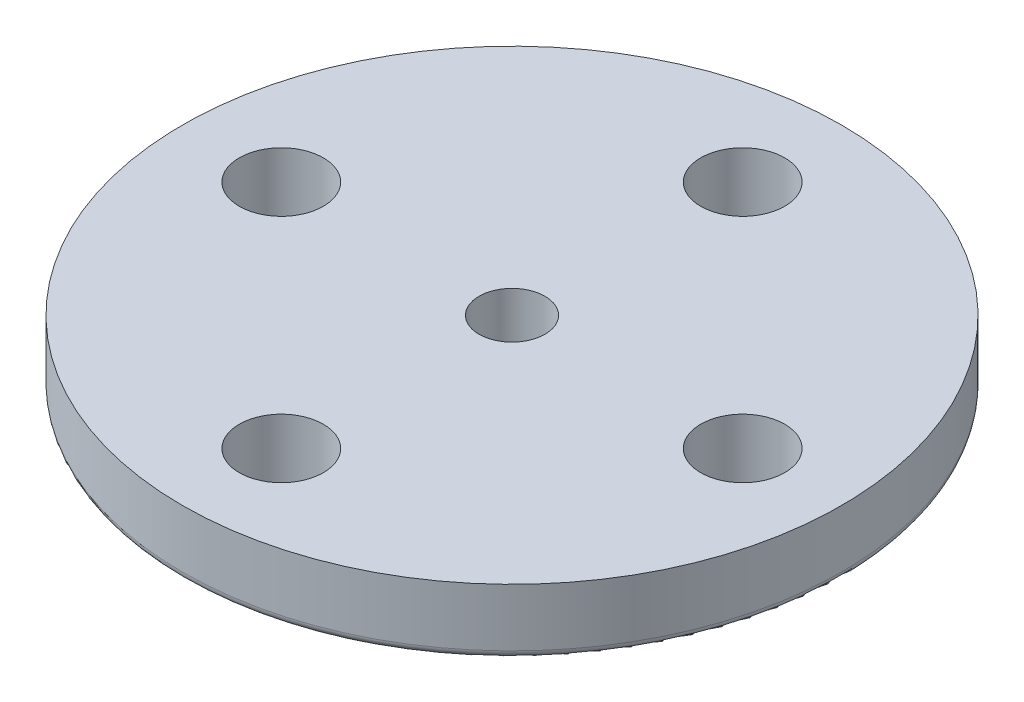
from build123d import *

# Parameters (mm, degrees)
SKETCH1_R           = 10
BOSS_EXTRUDE1_DEPTH = 2
SKETCH2_R           = 4.5
BOSS_EXTRUDE2_DEPTH = 2.5
SKETCH3_R           = 1.275
CUT_EXTRUDE1_DEPTH  = 15.361406616
FILLET1_R           = 0.25
SKETCH6_R           = 1
CUT_EXTRUDE2_DEPTH  = 15.840822214
SKETCH7_R           = 2.9
CUT_EXTRUDE3_DEPTH  = 2.5
BOSS_EXTRUDE4_DEPTH = 2.5
CIRPATTERN1_COUNT   = 26


with BuildPart() as part:
    # Sketch1 → Boss-Extrude1 (new body)
    with BuildSketch(Plane(origin=(0, 0, 0), x_dir=(1, 0, 0), z_dir=(0, 1, 0))):
        with Locations(Location((0, 0, 0), (0, 0, 270))):
            Circle(SKETCH1_R)
    extrude(amount=BOSS_EXTRUDE1_DEPTH)

    # Sketch2 → Boss-Extrude2 (add)
    with BuildSketch(Plane(origin=(0, 0, 0), x_dir=(1, 0, 0), z_dir=(0, 1, 0))):
        with Locations(Location((0, 0, 0), (0, 0, 270))):
            Circle(SKETCH2_R)
    extrude(amount=-BOSS_EXTRUDE2_DEPTH)

    # Sketch3 → Cut-Extrude1 (cut, through all)
    with BuildSketch(Plane(origin=(0, 0, 0), x_dir=(1, 0, 0), z_dir=(0, 1, 0))):
        with Locations(Location((0, 7, 0), (0, 0, 270))):
            Circle(SKETCH3_R)
        with Locations(Location((-7, 0, 0), (0, 0, 270))):
            Circle(SKETCH3_R)
        with Locations(Location((0, -7, 0), (0, 0, 90))):
            Circle(SKETCH3_R)
        with Locations(Location((7, 0, 0), (0, 0, 90))):
            Circle(SKETCH3_R)
    extrude(amount=CUT_EXTRUDE1_DEPTH, mode=Mode.SUBTRACT)

    # Fillet1
    fillet1_edges = [part.edges().sort_by_distance(p)[0] for p in [
        (0, 0, -10),
    ]]
    fillet(fillet1_edges, radius=FILLET1_R)

    # Sketch6 → Cut-Extrude2 (cut, through all)
    with BuildSketch(Plane(origin=(0, 2, 0), x_dir=(1, 0, 0), z_dir=(0, 1, 0))):
        with Locations(Location((0, 0, 0), (0, 0, 270))):
            Circle(SKETCH6_R)
    extrude(amount=-CUT_EXTRUDE2_DEPTH, mode=Mode.SUBTRACT)

    # Sketch7 → Cut-Extrude3 (cut)
    with BuildSketch(Plane.XZ.offset(2.5)):
        with Locations(Location((0, 0, 0), (0, 0, 270))):
            Circle(SKETCH7_R)
    extrude(amount=-CUT_EXTRUDE3_DEPTH, mode=Mode.SUBTRACT)

    # Sketch8 → Boss-Extrude4 (add)
    with BuildSketch(Plane.XZ.offset(2.5)):
        with BuildLine():
            Line((-2.35244742, -1.046531787), (-2.745588284, -0.933672842))
            ThreePointArc((-2.745588284, -0.933672842), (-2.649635472, -1.178741646), (-2.531859978, -1.414102207))
            Line((-2.531859978, -1.414102207), (-2.35244742, -1.046531787))
        make_face()
    boss_extrude4 = extrude(amount=-BOSS_EXTRUDE4_DEPTH)

    # CirPattern1: Boss-Extrude4 ×26 about axis
    cirpattern1_axis = Axis((0, 0, 0), (0, 1, 0))
    for i in range(1, CIRPATTERN1_COUNT):
        add(boss_extrude4.rotate(cirpattern1_axis, i * 360 / CIRPATTERN1_COUNT))


solid = part.part
